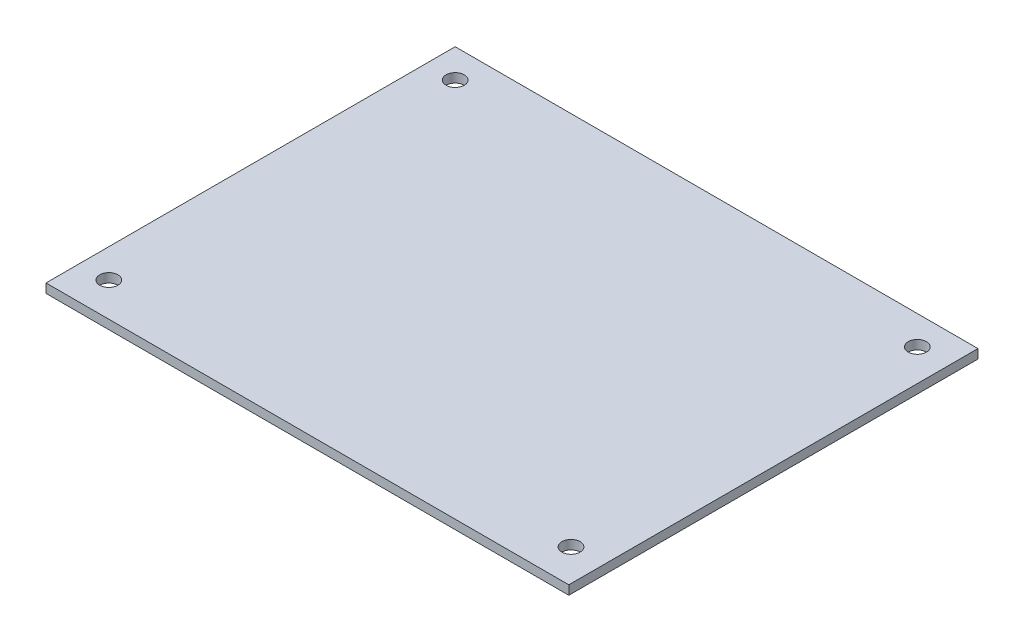
from build123d import *

# Parameters (mm, degrees)
SKETCH1_W           = 92
SKETCH1_H           = 72
SKETCH1_R           = 1.6
BOSS_EXTRUDE1_DEPTH = 1.6


with BuildPart() as part:
    # Sketch1 → Boss-Extrude1 (new body)
    with BuildSketch(Plane(origin=(0, 0, 0), x_dir=(1, 0, 0), z_dir=(0, 1, 0))):
        with Locations((46, 36)):
            Rectangle(SKETCH1_W, SKETCH1_H)
        with Locations(Location((5.08, 66.92, 0), (0, 0, 270))):
            Circle(SKETCH1_R, mode=Mode.SUBTRACT)
        with Locations(Location((86.412, 66.92, 0), (0, 0, 270))):
            Circle(SKETCH1_R, mode=Mode.SUBTRACT)
        with Locations(Location((86.412, 5.969, 0), (0, 0, 270))):
            Circle(SKETCH1_R, mode=Mode.SUBTRACT)
        with Locations(Location((5.08, 5.969, 0), (0, 0, 270))):
            Circle(SKETCH1_R, mode=Mode.SUBTRACT)
    extrude(amount=BOSS_EXTRUDE1_DEPTH)


solid = part.part
